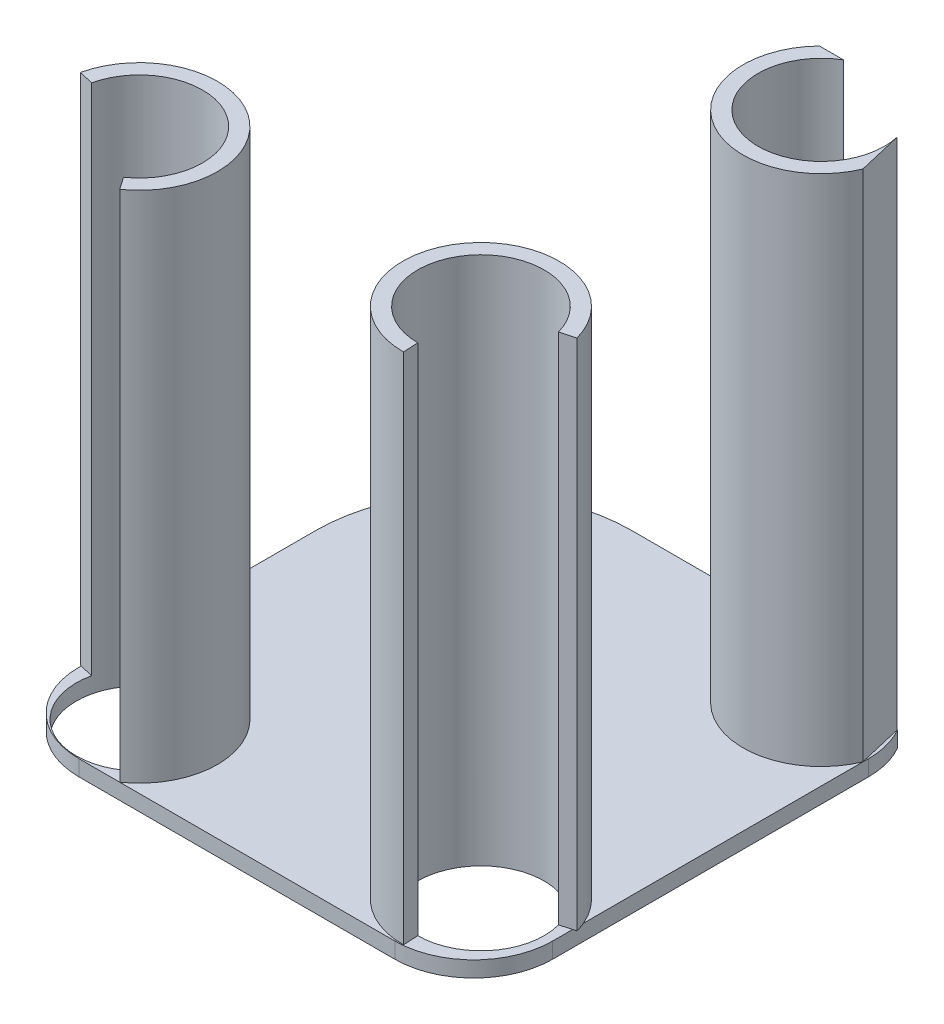
from build123d import *

# Parameters (mm, degrees)
BOSS_EXTRUDE1_DEPTH  = 2
BOSS_EXTRUDE9_DEPTH  = 65
SKETCH6_R            = 8
CUT_EXTRUDE3_DEPTH   = 78.787752397
SKETCH7_R            = 2
BOSS_EXTRUDE10_DEPTH = 10
SKETCH8_R            = 2
BOSS_EXTRUDE11_DEPTH = 10


with BuildPart() as part:
    # Sketch2 → Boss-Extrude1 (new body)
    with BuildSketch(Plane(origin=(0, 0, 0), x_dir=(1, 0, 0), z_dir=(0, 1, 0))):
        with BuildLine():
            Line((-10, 30), (20, 30))
            ThreePointArc((20, 30), (27.071067812, 27.071067812), (30, 20))
            Line((30, 20), (30, -20))
            ThreePointArc((30, -20), (27.071067812, -27.071067812), (20, -30))
            Line((20, -30), (-20, -30))
            ThreePointArc((-20, -30), (-27.071067812, -27.071067812), (-30, -20))
            Line((-30, -20), (-30, 10))
            ThreePointArc((-30, 10), (-24.142135624, 24.142135624), (-10, 30))
        make_face()
    extrude(amount=BOSS_EXTRUDE1_DEPTH)

    # Sketch5 → Boss-Extrude9 (add)
    with BuildSketch(Plane(origin=(0, 2, 0), x_dir=(1, 0, 0), z_dir=(0, 1, 0))):
        with BuildLine():
            Line((-30.116404199, -19.68082931), (-28.263425554, -20.100912803))
            ThreePointArc((-28.263425554, -20.100912803), (-15.988853518, -15.236719498), (-15.896791782, -28.439636592))
            Line((-15.896791782, -28.439636592), (-14.812694906, -30))
            ThreePointArc((-14.812694906, -30), (-14.926621305, -13.661390096), (-30.116404199, -19.68082931))
        make_face()
        with BuildLine():
            Line((20.977105182, -29.863851609), (20.875608793, -27.964371901))
            ThreePointArc((20.875608793, -27.964371901), (14.520196839, -15.105489427), (28.595658733, -17.866556627))
            Line((28.595658733, -17.866556627), (30.429170594, -17.368325499))
            ThreePointArc((30.429170594, -17.368325499), (12.980066991, -13.991900081), (20.977105182, -29.863851609))
        make_face()
        with BuildLine():
            Line((13.764397277, 30), (16.80629322, 30))
            ThreePointArc((16.80629322, 30), (17.733969491, 15.754964907), (28.664900588, 24.936269467))
            Line((28.664900588, 24.936269467), (29.994544588, 19.258061402))
            ThreePointArc((29.994544588, 19.258061402), (15.411631267, 14.856680059), (13.764397277, 30))
        make_face()
    extrude(amount=BOSS_EXTRUDE9_DEPTH)

    # Sketch6 → Cut-Extrude3 (cut, through all)
    with BuildSketch(Plane(origin=(0, 2, 0), x_dir=(1, 0, 0), z_dir=(0, 1, 0))):
        with Locations((20.875608793, 23.112281164)):
            Circle(SKETCH6_R)
        with Locations(Location((-20.461410206, -21.869685402, 0), (0, 0, 167.226551727))):
            Circle(SKETCH6_R)
        with Locations(Location((20.875608793, -19.964371901, 0), (0, 0, 270))):
            Circle(SKETCH6_R)
    extrude(amount=-CUT_EXTRUDE3_DEPTH, mode=Mode.SUBTRACT)

    # Sketch7 → Boss-Extrude10 (add)
    with BuildSketch(Plane.XZ):
        with Locations(Location((6.600213653, -6.067854065, 0), (0, 0, 90))):
            Circle(SKETCH7_R)
    extrude(amount=BOSS_EXTRUDE10_DEPTH)

    # Sketch8 → Boss-Extrude11 (add)
    with BuildSketch(Plane.XZ):
        with Locations(Location((-5.40151955, 9.120930292, 0), (0, 0, 90))):
            Circle(SKETCH8_R)
    extrude(amount=BOSS_EXTRUDE11_DEPTH)


solid = part.part
